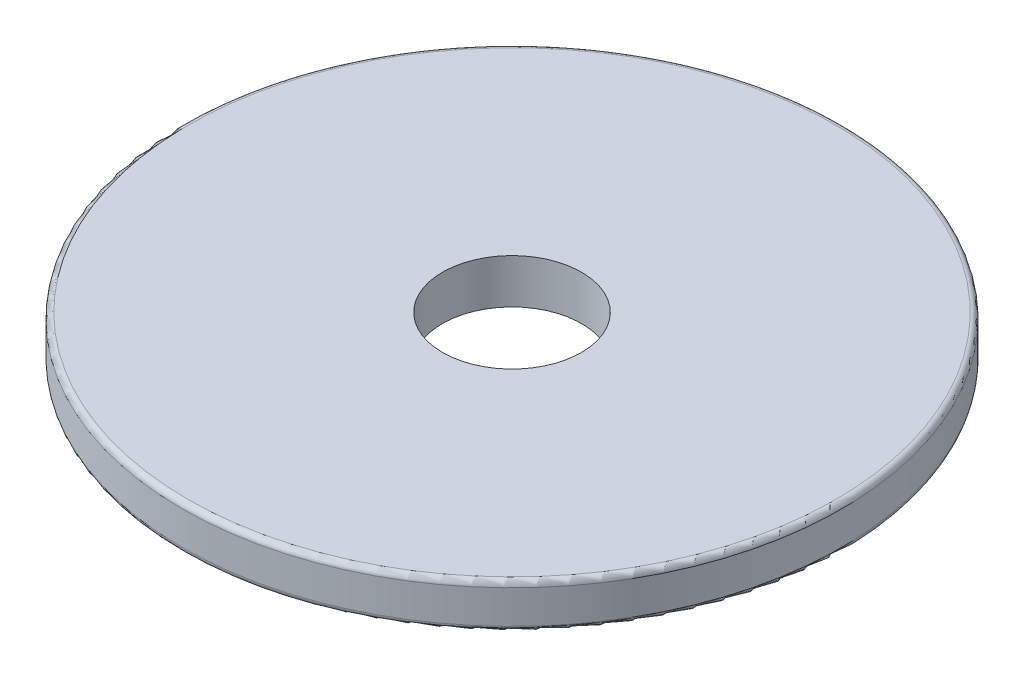
from build123d import *

# Parameters (mm, degrees)
ESBO_O1_R                = 11.85
ESBO_O1_R_2              = 2.5
RESSALTO_EXTRUS_O1_DEPTH = 0.8
FILETE1_R                = 0.2


with BuildPart() as part:
    # Esboço1 → Ressalto-extrusão1 (new, symmetric)
    with BuildSketch(Plane(origin=(0, 0, 0), x_dir=(1, 0, 0), z_dir=(0, 1, 0))):
        with Locations(Location((0, 0, 0), (0, 0, 270))):
            Circle(ESBO_O1_R)
        with Locations(Location((0, 0, 0), (0, 0, 270))):
            Circle(ESBO_O1_R_2, mode=Mode.SUBTRACT)
    extrude(amount=RESSALTO_EXTRUS_O1_DEPTH, both=True)

    # Filete1
    filete1_edges = [part.edges().sort_by_distance(p)[0] for p in [
        (0, -0.8, -11.85),
        (0, 0.8, -11.85),
    ]]
    fillet(filete1_edges, radius=FILETE1_R)


solid = part.part
